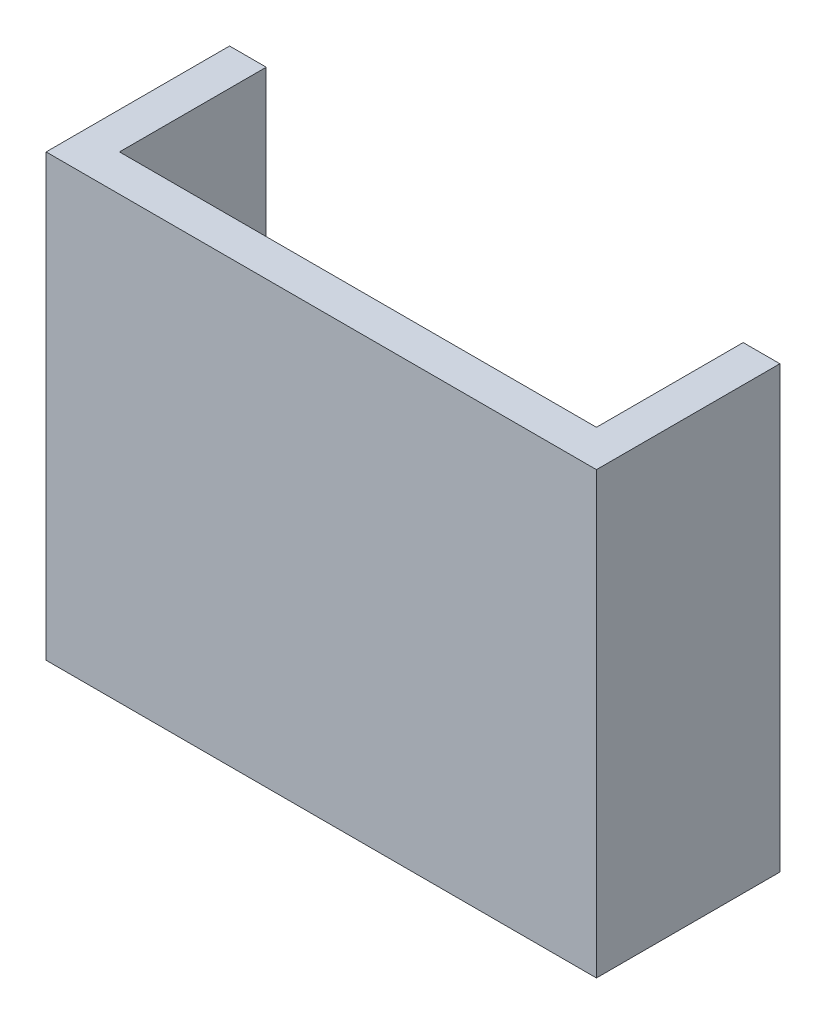
from build123d import *

# Parameters (mm, degrees)
SKETCH_1_W          = 30
SKETCH_1_H          = 24
EXTRUDE_1_DEPTH     = 10
SKETCH_2_W          = 26
SKETCH_2_H          = 24
CUT_EXTRUDE_1_DEPTH = 8


with BuildPart() as part:
    # 草圖1 → 填料-伸長1 (new body)
    with BuildSketch(Plane.XY):
        with Locations((-15, 12)):
            Rectangle(SKETCH_1_W, SKETCH_1_H)
    extrude(amount=EXTRUDE_1_DEPTH)

    # 草圖2 → 除料-伸長1 (cut)
    with BuildSketch(Plane(origin=(0, 0, 0), x_dir=(-1, 0, 0), z_dir=(0, 0, -1))):
        with Locations((15, 12)):
            Rectangle(SKETCH_2_W, SKETCH_2_H)
    extrude(amount=-CUT_EXTRUDE_1_DEPTH, mode=Mode.SUBTRACT)


solid = part.part
